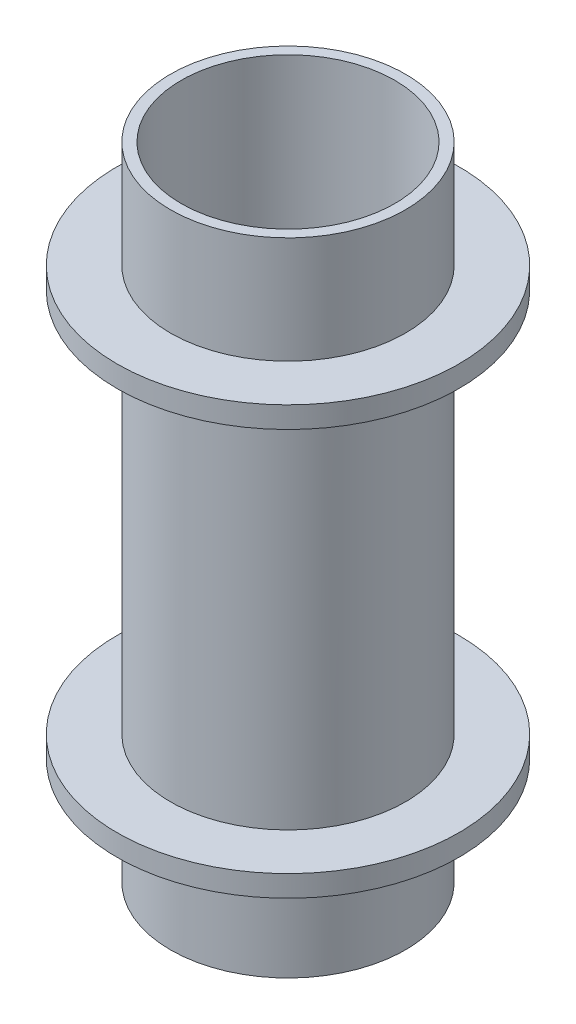
from build123d import *

# Parameters (mm, degrees)
SKETCH_1_R      = 11
SKETCH_1_R_2    = 10
EXTRUDE_1_DEPTH = 60
EXTRUDE_START   = -12
SKETCH_2_R      = 16
SKETCH_2_R_2    = 11
EXTRUDE_3_DEPTH = 2
EXTRUDE_START_2 = -10
SKETCH_3_R      = 16
SKETCH_3_R_2    = 11
EXTRUDE_4_DEPTH = 2


with BuildPart() as part:
    # Эскиз1 → Бобышка-Вытянуть1 (new body)
    with BuildSketch(Plane(origin=(0, 0, 0), x_dir=(1, 0, 0), z_dir=(0, 1, 0))):
        with Locations(Location((0, 0, 0), (0, 0, 270))):
            Circle(SKETCH_1_R)
        with Locations(Location((0, 0, 0), (0, 0, 270))):
            Circle(SKETCH_1_R_2, mode=Mode.SUBTRACT)
    extrude(amount=EXTRUDE_1_DEPTH)

    # Эскиз2 → Бобышка-Вытянуть3 (add)
    with BuildSketch(Plane(origin=(0, 60, 0), x_dir=(1, 0, 0), z_dir=(0, 1, 0)).offset(EXTRUDE_START)):
        with Locations(Location((0, 0, 0), (0, 0, 270))):
            Circle(SKETCH_2_R)
        with Locations(Location((0, 0, 0), (0, 0, 270))):
            Circle(SKETCH_2_R_2, mode=Mode.SUBTRACT)
    extrude(amount=EXTRUDE_3_DEPTH)

    # Эскиз3 → Бобышка-Вытянуть4 (add)
    with BuildSketch(Plane.XZ.offset(EXTRUDE_START_2)):
        with Locations(Location((0, 0, 0), (0, 0, 90))):
            Circle(SKETCH_3_R)
        with Locations(Location((0, 0, 0), (0, 0, 270))):
            Circle(SKETCH_3_R_2, mode=Mode.SUBTRACT)
    extrude(amount=-EXTRUDE_4_DEPTH)


solid = part.part
